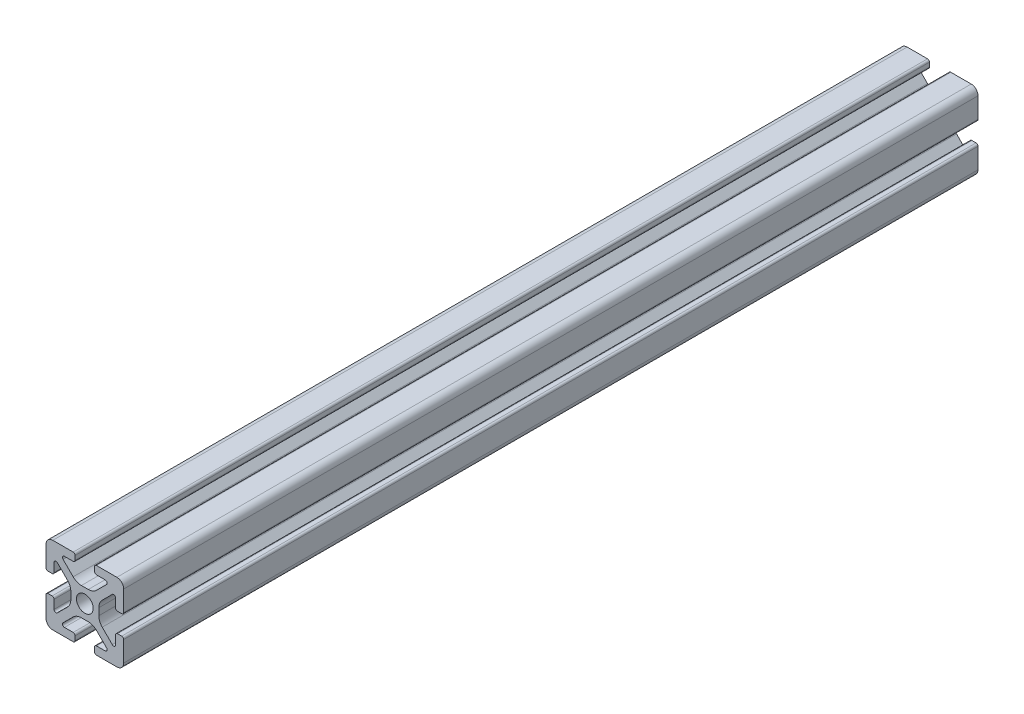
from build123d import *

# Parameters (mm, degrees)
BOSS_EXTRUDE1_DEPTH = 110


with BuildPart() as part:
    # Sketch4 → Boss-Extrude1 (new, symmetric)
    with BuildSketch(Plane.XY):
        with BuildLine():
            Line((3, -10), (8.25, -10))
            ThreePointArc((8.25, -10), (9.487436867, -9.487436867), (10, -8.25))
            Line((10, -8.25), (10, -3))
            ThreePointArc((10, -3), (9.853553391, -2.646446609), (9.5, -2.5))
            Line((9.5, -2.5), (8.424621202, -2.5))
            ThreePointArc((8.424621202, -2.5), (8.071067812, -2.646446609), (7.924621202, -3))
            Line((7.924621202, -3), (7.924621202, -5.25))
            ThreePointArc((7.924621202, -5.25), (7.615962919, -5.711939766), (7.071067812, -5.603553391))
            Line((7.071067812, -5.603553391), (4.478679656, -3.011165235))
            ThreePointArc((4.478679656, -3.011165235), (3.828361402, -2.037895189), (3.6, -0.889844892))
            Line((3.6, -0.889844892), (3.6, 0))
            Line((3.6, 0), (2.15, 0))
            ThreePointArc((2.15, 0), (1.52027958, -1.52027958), (0, -2.15))
            Line((0, -2.15), (0, -3.6))
            Line((0, -3.6), (0.889844892, -3.6))
            ThreePointArc((0.889844892, -3.6), (2.037895189, -3.828361402), (3.011165235, -4.478679656))
            Line((3.011165235, -4.478679656), (5.603553391, -7.071067812))
            ThreePointArc((5.603553391, -7.071067812), (5.711939766, -7.615962919), (5.25, -7.924621202))
            Line((5.25, -7.924621202), (3, -7.924621202))
            ThreePointArc((3, -7.924621202), (2.646446609, -8.071067812), (2.5, -8.424621202))
            Line((2.5, -8.424621202), (2.5, -9.5))
            ThreePointArc((2.5, -9.5), (2.646446609, -9.853553391), (3, -10))
        make_face()
    extrude(amount=BOSS_EXTRUDE1_DEPTH, both=True)

    # Mirror1: part across plane


with BuildPart() as part_1:
    add(part.part)
    add(part.part.mirror(Plane(origin=(0, 0, 0), x_dir=(0, 0, 1), z_dir=(1, 0, 0))))

    # Mirror2: part across plane


with BuildPart() as part_2:
    add(part_1.part)
    add(part_1.part.mirror(Plane.ZX))


solid = part_2.part
